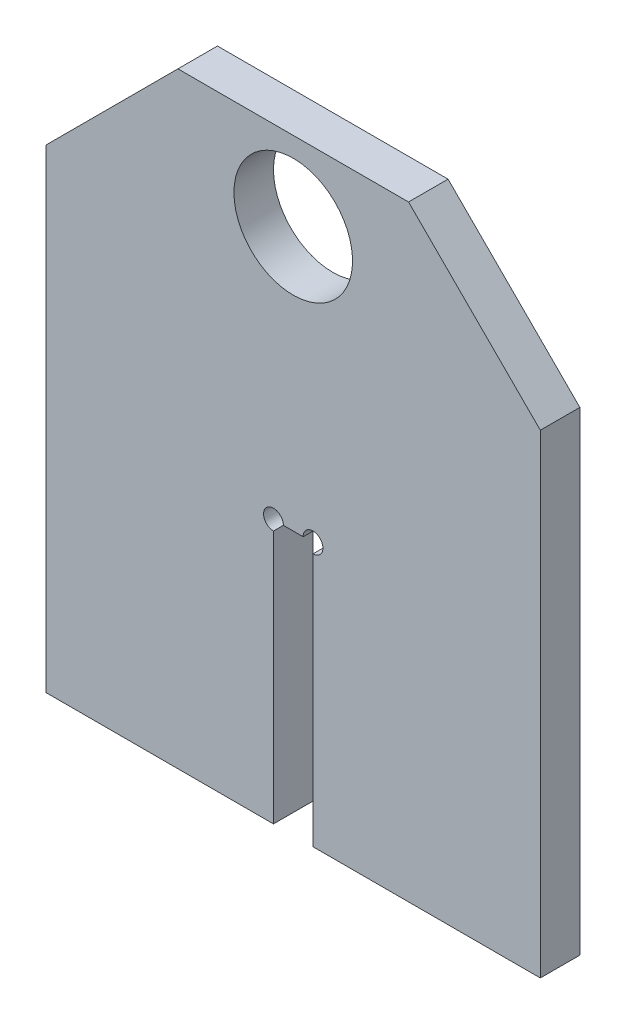
from build123d import *

# Parameters (mm, degrees)
SKETCH1_R           = 9
BOSS_EXTRUDE1_DEPTH = 6


with BuildPart() as part:
    # Sketch1 → Boss-Extrude1 (new body)
    with BuildSketch(Plane.XY):
        with BuildLine():
            Line((3, 160), (37.5, 160))
            Line((37.5, 160), (37.5, 232.000025877))
            Line((37.5, 232.000025877), (17.5, 252.000025877))
            Line((17.5, 252.000025877), (-17.5, 252.000025877))
            Line((-17.5, 252.000025877), (-37.5, 232.000025877))
            Line((-37.5, 232.000025877), (-37.5, 160))
            Line((-37.5, 160), (-3, 160))
            Line((-3, 160), (-3, 198.5))
            ThreePointArc((-3, 198.5), (-4.060660172, 201.060660172), (-1.5, 200))
            Line((-1.5, 200), (1.5, 200))
            ThreePointArc((1.5, 200), (3, 201.5), (4.5, 200))
            ThreePointArc((4.5, 200), (4.060660172, 198.939339828), (3, 198.5))
            Line((3, 198.5), (3, 160))
        make_face()
        with Locations(Location((9.65e-05, 239.99993797, 0), (0, 0, 180))):
            Circle(SKETCH1_R, mode=Mode.SUBTRACT)
    extrude(amount=BOSS_EXTRUDE1_DEPTH)


solid = part.part
